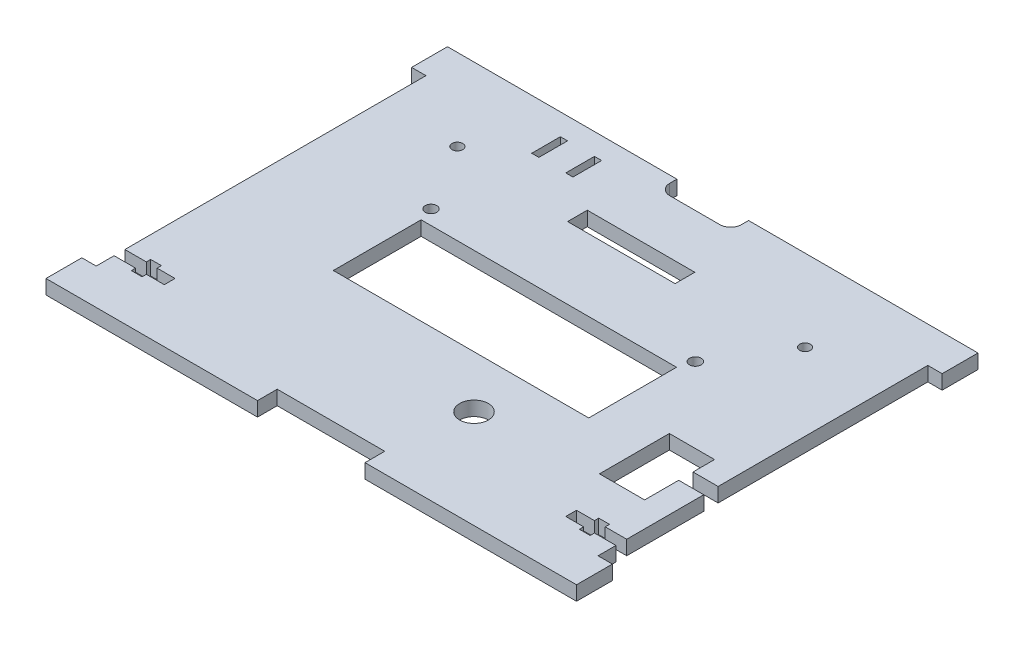
from build123d import *

# Parameters (mm, degrees)
SKETCH1_R           = 1.5
SKETCH1_R_2         = 4
SKETCH1_R_3         = 1.625
SKETCH1_W           = 30
SKETCH1_H           = 5.5
SKETCH1_W_2         = 2
SKETCH1_H_2         = 8
SKETCH1_W_3         = 71.25
SKETCH1_H_3         = 24.5
BOSS_EXTRUDE1_DEPTH = 4
FILLET1_R           = 3
FILLET2_R           = 3


with BuildPart() as part:
    # Sketch1 → Boss-Extrude1 (new body)
    with BuildSketch(Plane(origin=(0, 0, 0), x_dir=(1, 0, 0), z_dir=(0, 1, 0))):
        Polygon((85, 0), (140, 0), (144, 0), (144, 10), (140, 10), (140, 15), (134, 15), (134, 13.8), (131, 13.8), (131, 15), (126, 15), (126, 18), (131, 18), (131, 19.2), (134, 19.2), (134, 18), (140, 18), (140, 39.5), (133, 39.5), (133, 30), (120.4, 30), (120.4, 49.5), (133, 49.5), (133, 43.5), (140, 43.5), (140, 102), (144, 102), (144, 112), (140, 112), (80, 112), (80, 107), (60, 107), (60, 112), (0, 112), (-4, 112), (-4, 102), (0, 102), (0, 18), (6, 18), (6, 19.2), (9, 19.2), (9, 18), (14, 18), (14, 15), (9, 15), (9, 13.8), (6, 13.8), (6, 15), (0, 15), (0, 10), (-4, 10), (-4, 0), (0, 0), (55, 0), (55, 5.5), (85, 5.5), align=None)
        with Locations(Location((21.5, 89.25, 0), (0, 0, 270))):
            Circle(SKETCH1_R, mode=Mode.SUBTRACT)
        with Locations(Location((118.5, 89.25, 0), (0, 0, 270))):
            Circle(SKETCH1_R, mode=Mode.SUBTRACT)
        with Locations(Location((87.9, 27.5, 0), (0, 0, 270))):
            Circle(SKETCH1_R_2, mode=Mode.SUBTRACT)
        with Locations(Location((32.9, 70.5, 0), (0, 0, 270))):
            Circle(SKETCH1_R_3, mode=Mode.SUBTRACT)
        with Locations(Location((106.65, 70.5, 0), (0, 0, 270))):
            Circle(SKETCH1_R_3, mode=Mode.SUBTRACT)
        with Locations((70, 89.25)):
            Rectangle(SKETCH1_W, SKETCH1_H, mode=Mode.SUBTRACT)
        with Locations((34.5, 102)):
            Rectangle(SKETCH1_W_2, SKETCH1_H_2, mode=Mode.SUBTRACT)
        with Locations((44, 102)):
            Rectangle(SKETCH1_W_2, SKETCH1_H_2, mode=Mode.SUBTRACT)
        with Locations((69.775, 54.25)):
            Rectangle(SKETCH1_W_3, SKETCH1_H_3, mode=Mode.SUBTRACT)
    extrude(amount=BOSS_EXTRUDE1_DEPTH)

    # Fillet1
    fillet1_edges = [part.edges().sort_by_distance(p)[0] for p in [
        (60, 2, -107),
    ]]
    fillet(fillet1_edges, radius=FILLET1_R)

    # Fillet2
    fillet2_edges = [part.edges().sort_by_distance(p)[0] for p in [
        (80, 2, -107),
    ]]
    fillet(fillet2_edges, radius=FILLET2_R)


solid = part.part
